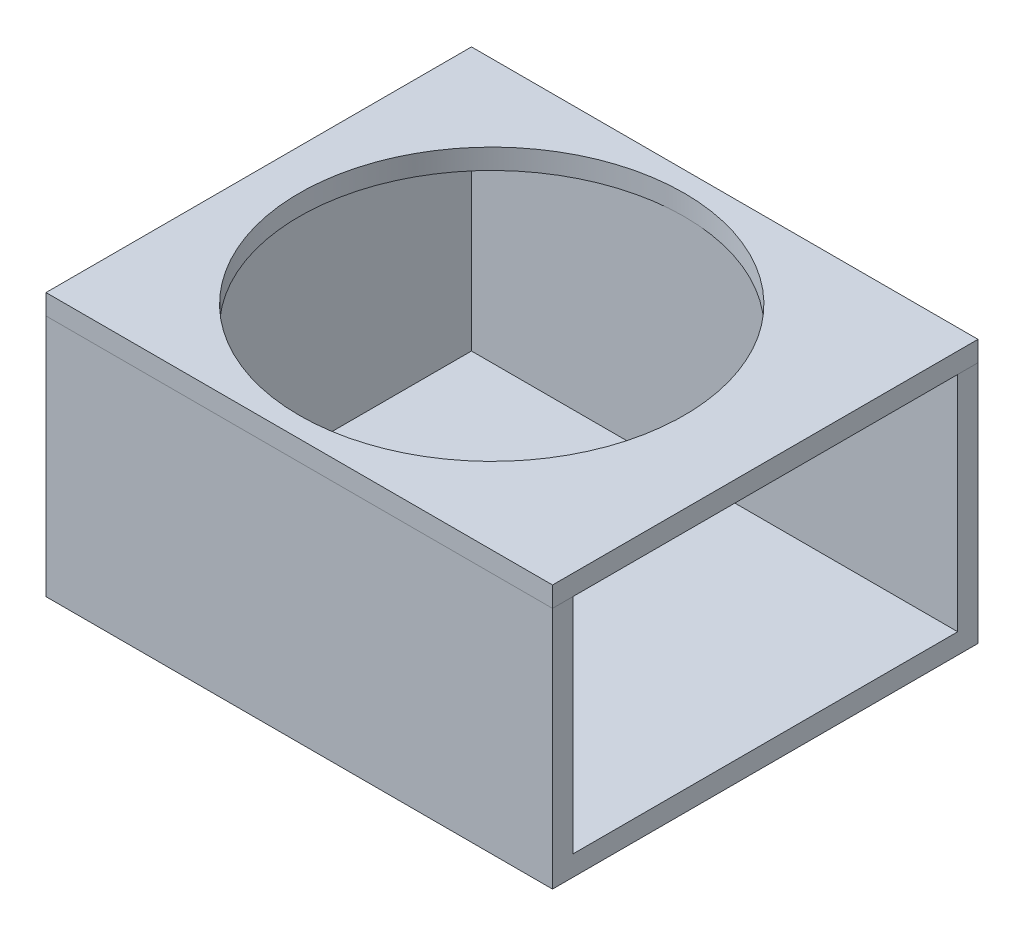
from build123d import *

# Parameters (mm, degrees)
SKETCH_1_W          = 25
SKETCH_1_H          = 21
EXTRUDE_1_DEPTH     = 12
CUT_EXTRUDE_START   = 1
SKETCH_2_W          = 25
SKETCH_2_H          = 19
CUT_EXTRUDE_1_DEPTH = 11
EXTRUDE_START       = 12
SKETCH_6_W          = 25
SKETCH_6_H          = 21
EXTRUDE_3_DEPTH     = 1
CUT_EXTRUDE_START_2 = 13
SKETCH_8_R          = 9.5
CUT_EXTRUDE_2_DEPTH = 1


with BuildPart() as part:
    # 스케치1 → 보스-돌출1 (new body)
    with BuildSketch(Plane(origin=(0, 0, 0), x_dir=(1, 0, 0), z_dir=(0, 1, 0))):
        Rectangle(SKETCH_1_W, SKETCH_1_H)
    extrude(amount=EXTRUDE_1_DEPTH)

    # 스케치2 → 컷-돌출1 (cut)
    with BuildSketch(Plane(origin=(0, 0, 0), x_dir=(1, 0, 0), z_dir=(0, 1, 0)).offset(CUT_EXTRUDE_START)):
        with Locations((1, 0)):
            Rectangle(SKETCH_2_W, SKETCH_2_H)
    extrude(amount=CUT_EXTRUDE_1_DEPTH, mode=Mode.SUBTRACT)


with BuildPart() as body_2:
    # 스케치6 → 보스-돌출3 (new body)
    with BuildSketch(Plane(origin=(0, 0, 0), x_dir=(1, 0, 0), z_dir=(0, 1, 0)).offset(EXTRUDE_START)):
        Rectangle(SKETCH_6_W, SKETCH_6_H)
    extrude(amount=EXTRUDE_3_DEPTH)

    # 스케치8 → 컷-돌출2 (cut)
    with BuildSketch(Plane(origin=(0, 0, 0), x_dir=(1, 0, 0), z_dir=(0, 1, 0)).offset(CUT_EXTRUDE_START_2)):
        with Locations(Location((-1, 0, 0), (0, 0, 270))):
            Circle(SKETCH_8_R)
    extrude(amount=-CUT_EXTRUDE_2_DEPTH, mode=Mode.SUBTRACT)


solid = Compound([part.part, body_2.part])
